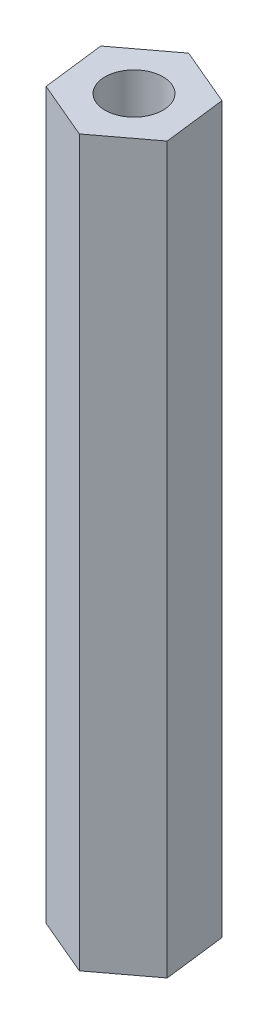
from build123d import *

# Parameters (mm, degrees)
SKETCH_1_R      = 1.6
EXTRUDE_1_DEPTH = 40


with BuildPart() as part:
    # 草图1 → 凸台-拉伸1 (new body)
    with BuildSketch(Plane(origin=(0, 0, 0), x_dir=(1, 0, 0), z_dir=(0, 1, 0))):
        Polygon((2.767176381, 2.083922954), (-0.421142027, 3.438406519), (-3.188318408, 1.354483566), (-2.767176381, -2.083922954), (0.421142027, -3.438406519), (3.188318408, -1.354483566), align=None)
        with Locations(Location((0, 0, 0), (0, 0, 270))):
            Circle(SKETCH_1_R, mode=Mode.SUBTRACT)
    extrude(amount=EXTRUDE_1_DEPTH)


solid = part.part
